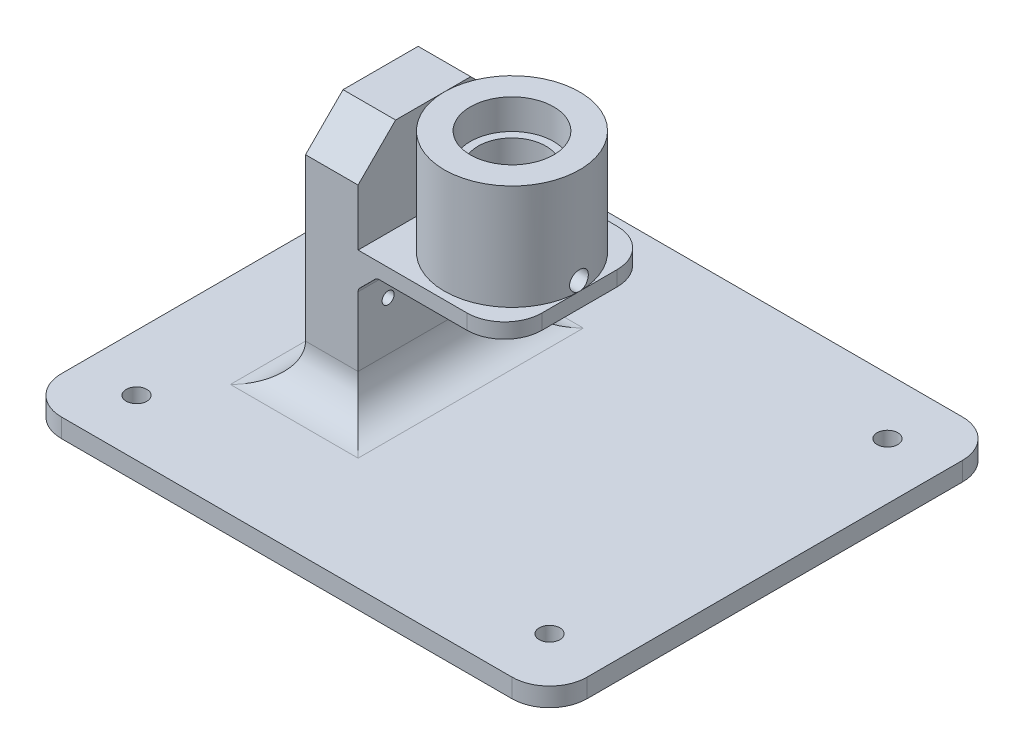
from build123d import *

# Parameters (mm, degrees)
BENCH_FOOTPRINT_140X120_DEPTH           = 5
BACKBONE_START                          = -20
BACKBONE_PROFILE_W                      = 14
BACKBONE_PROFILE_H                      = 63
BACKBONE_DEPTH                          = 40
REMOVABLE_SERVO_MOUNT_M3_START          = -40
REMOVABLE_SERVO_MOUNT_M3_PROFILE_R      = 1.6
REMOVABLE_SERVO_MOUNT_M3_DEPTH          = 155.560027933
BEARING_BRIDGE_START                    = 39
BEARING_BRIDGE_PROFILE_W                = 53
BEARING_BRIDGE_PROFILE_H                = 40
BEARING_BRIDGE_DEPTH                    = 4
BRIDGE_HORN_CLEARANCE_START             = 38
BRIDGE_HORN_CLEARANCE_PROFILE_R         = 14
BRIDGE_HORN_CLEARANCE_DEPTH             = 77.560027933
DRIVE_COLLAR_CHAMBER_START              = 43
DRIVE_COLLAR_CHAMBER_PROFILE_R          = 18
DRIVE_COLLAR_CHAMBER_PROFILE_R_2        = 14
DRIVE_COLLAR_CHAMBER_DEPTH              = 5
BEARING_TOWER_START                     = 48
BEARING_TOWER_PROFILE_R                 = 18
BEARING_TOWER_PROFILE_R_2               = 11.1
BEARING_TOWER_DEPTH                     = 23
BEARING_SEPARATION_SHOULDER_START       = 55
BEARING_SEPARATION_SHOULDER_PROFILE_R   = 11.1
BEARING_SEPARATION_SHOULDER_PROFILE_R_2 = 9
BEARING_SEPARATION_SHOULDER_DEPTH       = 8
BENCH_CLAMP_HOLES_START                 = -1
BENCH_CLAMP_HOLES_PROFILE_R             = 2.75
BENCH_CLAMP_HOLES_DEPTH                 = 118.365802537
YAW_CROSSBOLT_ACCESS_START              = -40
YAW_CROSSBOLT_ACCESS_PROFILE_R          = 2.5
YAW_CROSSBOLT_ACCESS_DEPTH              = 157.365802537
FILLET2_R                               = 10
BOSS_EXTRUDE1_DEPTH                     = 40
FILLET6_R                               = 1.5
FILLET7_R                               = 10
CHAMFER1_SIZE                           = 10


with BuildPart() as part:
    # Bench_footprint_140x120_profile → Bench_footprint_140x120 (new body)
    with BuildSketch(Plane(origin=(0, 0, 0), x_dir=(1, 0, 0), z_dir=(0, 1, 0))):
        with BuildLine():
            Line((-60, -60), (60, -60))
            ThreePointArc((60, -60), (67.071067812, -57.071067812), (70, -50))
            Line((70, -50), (70, 50))
            ThreePointArc((70, 50), (67.071067812, 57.071067812), (60, 60))
            Line((60, 60), (-60, 60))
            ThreePointArc((-60, 60), (-67.071067812, 57.071067812), (-70, 50))
            Line((-70, 50), (-70, -50))
            ThreePointArc((-70, -50), (-67.071067812, -57.071067812), (-60, -60))
        make_face()
    extrude(amount=BENCH_FOOTPRINT_140X120_DEPTH)

    # Backbone_profile → Backbone (add)
    with BuildSketch(Plane.XY.offset(BACKBONE_START)):
        with Locations((-28, 36.5)):
            Rectangle(BACKBONE_PROFILE_W, BACKBONE_PROFILE_H)
    extrude(amount=BACKBONE_DEPTH)

    # Removable_servo_mount_M3_profile → Removable_servo_mount_M3 (cut, through all)
    with BuildSketch(Plane(origin=(0, 0, 0), x_dir=(0, 0, -1), z_dir=(1, 0, 0)).offset(REMOVABLE_SERVO_MOUNT_M3_START)):
        with Locations(Location((12, 28, 0), (0, 0, 180))):
            Circle(REMOVABLE_SERVO_MOUNT_M3_PROFILE_R)
        with Locations(Location((-12, 28, 0), (0, 0, 180))):
            Circle(REMOVABLE_SERVO_MOUNT_M3_PROFILE_R)
    extrude(amount=REMOVABLE_SERVO_MOUNT_M3_DEPTH, mode=Mode.SUBTRACT)

    # Bearing_bridge_profile → Bearing_bridge (add)
    with BuildSketch(Plane(origin=(0, 0, 0), x_dir=(1, 0, 0), z_dir=(0, 1, 0)).offset(BEARING_BRIDGE_START)):
        with Locations((-8.5, 0)):
            Rectangle(BEARING_BRIDGE_PROFILE_W, BEARING_BRIDGE_PROFILE_H)
    extrude(amount=BEARING_BRIDGE_DEPTH)

    # Bridge_horn_clearance_profile → Bridge_horn_clearance (cut, through all)
    with BuildSketch(Plane(origin=(0, 0, 0), x_dir=(1, 0, 0), z_dir=(0, 1, 0)).offset(BRIDGE_HORN_CLEARANCE_START)):
        with Locations(Location((0, 0, 0), (0, 0, 90))):
            Circle(BRIDGE_HORN_CLEARANCE_PROFILE_R)
    extrude(amount=BRIDGE_HORN_CLEARANCE_DEPTH, mode=Mode.SUBTRACT)

    # Drive_collar_chamber_profile → Drive_collar_chamber (add)
    with BuildSketch(Plane(origin=(0, 0, 0), x_dir=(1, 0, 0), z_dir=(0, 1, 0)).offset(DRIVE_COLLAR_CHAMBER_START)):
        Circle(DRIVE_COLLAR_CHAMBER_PROFILE_R)
        with Locations(Location((0, 0, 0), (0, 0, 90))):
            Circle(DRIVE_COLLAR_CHAMBER_PROFILE_R_2, mode=Mode.SUBTRACT)
    extrude(amount=DRIVE_COLLAR_CHAMBER_DEPTH)

    # Bearing_tower_profile → Bearing_tower (add)
    with BuildSketch(Plane(origin=(0, 0, 0), x_dir=(1, 0, 0), z_dir=(0, 1, 0)).offset(BEARING_TOWER_START)):
        Circle(BEARING_TOWER_PROFILE_R)
        with Locations(Location((0, 0, 0), (0, 0, 270))):
            Circle(BEARING_TOWER_PROFILE_R_2, mode=Mode.SUBTRACT)
    extrude(amount=BEARING_TOWER_DEPTH)

    # Bearing_separation_shoulder_profile → Bearing_separation_shoulder (add)
    with BuildSketch(Plane(origin=(0, 0, 0), x_dir=(1, 0, 0), z_dir=(0, 1, 0)).offset(BEARING_SEPARATION_SHOULDER_START)):
        with Locations(Location((0, 0, 0), (0, 0, 270))):
            Circle(BEARING_SEPARATION_SHOULDER_PROFILE_R)
        with Locations(Location((0, 0, 0), (0, 0, 270))):
            Circle(BEARING_SEPARATION_SHOULDER_PROFILE_R_2, mode=Mode.SUBTRACT)
    extrude(amount=BEARING_SEPARATION_SHOULDER_DEPTH)

    # Bench_clamp_holes_profile → Bench_clamp_holes (cut, through all)
    with BuildSketch(Plane(origin=(0, 0, 0), x_dir=(1, 0, 0), z_dir=(0, 1, 0)).offset(BENCH_CLAMP_HOLES_START)):
        with Locations(Location((-55, -45, 0), (0, 0, 270))):
            Circle(BENCH_CLAMP_HOLES_PROFILE_R)
        with Locations(Location((55, -45, 0), (0, 0, 270))):
            Circle(BENCH_CLAMP_HOLES_PROFILE_R)
        with Locations(Location((-55, 45, 0), (0, 0, 270))):
            Circle(BENCH_CLAMP_HOLES_PROFILE_R)
        with Locations(Location((55, 45, 0), (0, 0, 270))):
            Circle(BENCH_CLAMP_HOLES_PROFILE_R)
    extrude(amount=BENCH_CLAMP_HOLES_DEPTH, mode=Mode.SUBTRACT)

    # Yaw_crossbolt_access_profile → Yaw_crossbolt_access (cut, through all)
    with BuildSketch(Plane(origin=(0, 0, 0), x_dir=(0, 0, -1), z_dir=(1, 0, 0)).offset(YAW_CROSSBOLT_ACCESS_START)):
        with Locations(Location((0, 45.5, 0), (0, 0, 90))):
            Circle(YAW_CROSSBOLT_ACCESS_PROFILE_R)
    extrude(amount=YAW_CROSSBOLT_ACCESS_DEPTH, mode=Mode.SUBTRACT)

    # Fillet2
    fillet2_edges = [part.edges().sort_by_distance(p)[0] for p in [
        (18, 41, -20),
        (18, 41, 20),
    ]]
    fillet(fillet2_edges, radius=FILLET2_R)

    # Sketch1 → Boss-Extrude1 (add)
    with BuildSketch(Plane.XY.offset(20)):
        Polygon((-21, 34), (-16, 39), (-21, 39), align=None)
    extrude(amount=-BOSS_EXTRUDE1_DEPTH)

    # Fillet6
    fillet6_edges = [part.edges().sort_by_distance(p)[0] for p in [
        (-16, 39, 0),
        (-21, 34, 0),
    ]]
    fillet(fillet6_edges, radius=FILLET6_R)

    # Fillet7
    fillet7_edges = [part.edges().sort_by_distance(p)[0] for p in [
        (-28, 5, -20),
        (-35, 5, 0),
        (-21, 5, 0),
        (-28, 5, 20),
    ]]
    fillet(fillet7_edges, radius=FILLET7_R)

    # Chamfer1
    chamfer1_edges = [part.edges().sort_by_distance(p)[0] for p in [
        (-28, 68, -20),
        (-28, 68, 20),
    ]]
    chamfer(chamfer1_edges, length=CHAMFER1_SIZE)


solid = part.part
